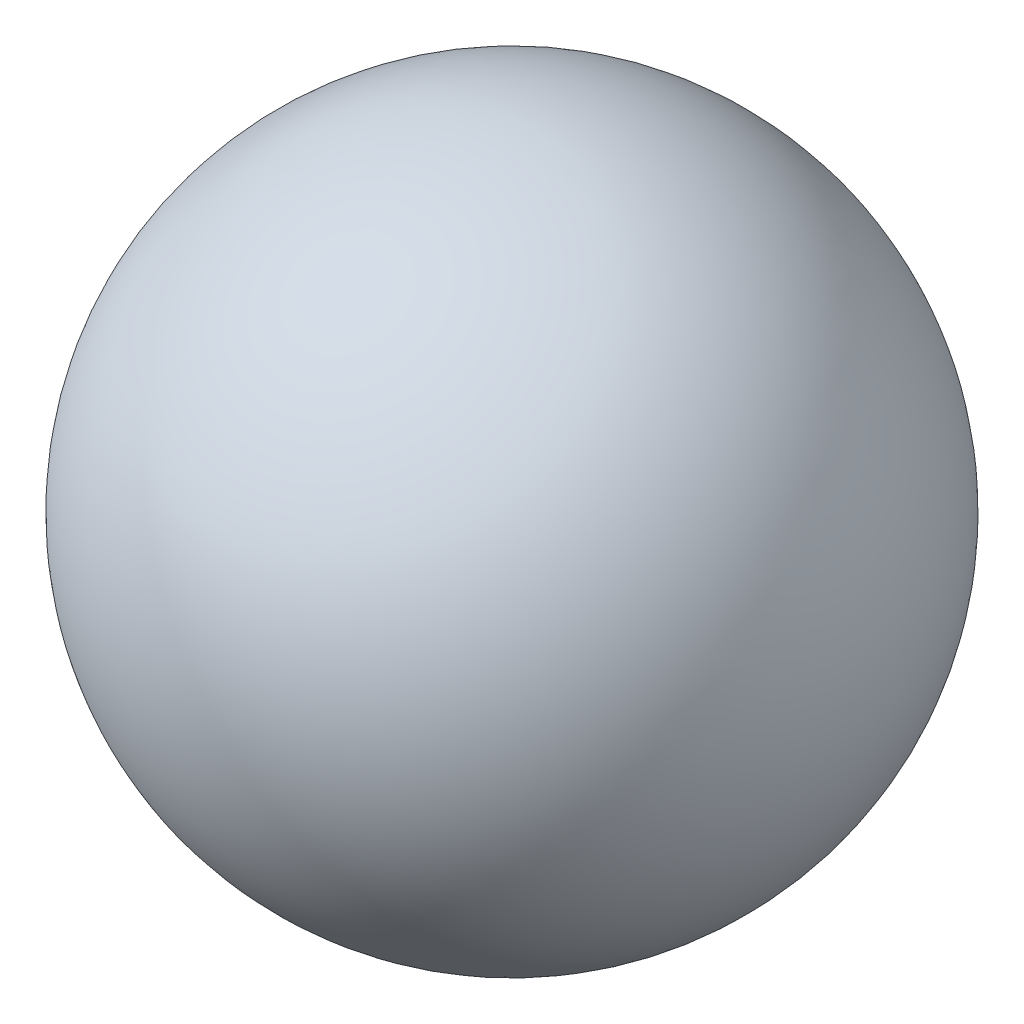
from build123d import *


with BuildPart() as part:
    # Sketch1 → Revolve1 (revolve)
    with BuildSketch(Plane(origin=(0, 0, 0), x_dir=(1, 0, 0), z_dir=(0, 1, 0))):
        with BuildLine():
            Line((0, 33.5), (0, -33.5))
            ThreePointArc((0, -33.5), (-33.5, 0), (0, 33.5))
        make_face()
    revolve(axis=Axis((0, 0, -33.5), (0, 0, 1)))


solid = part.part
